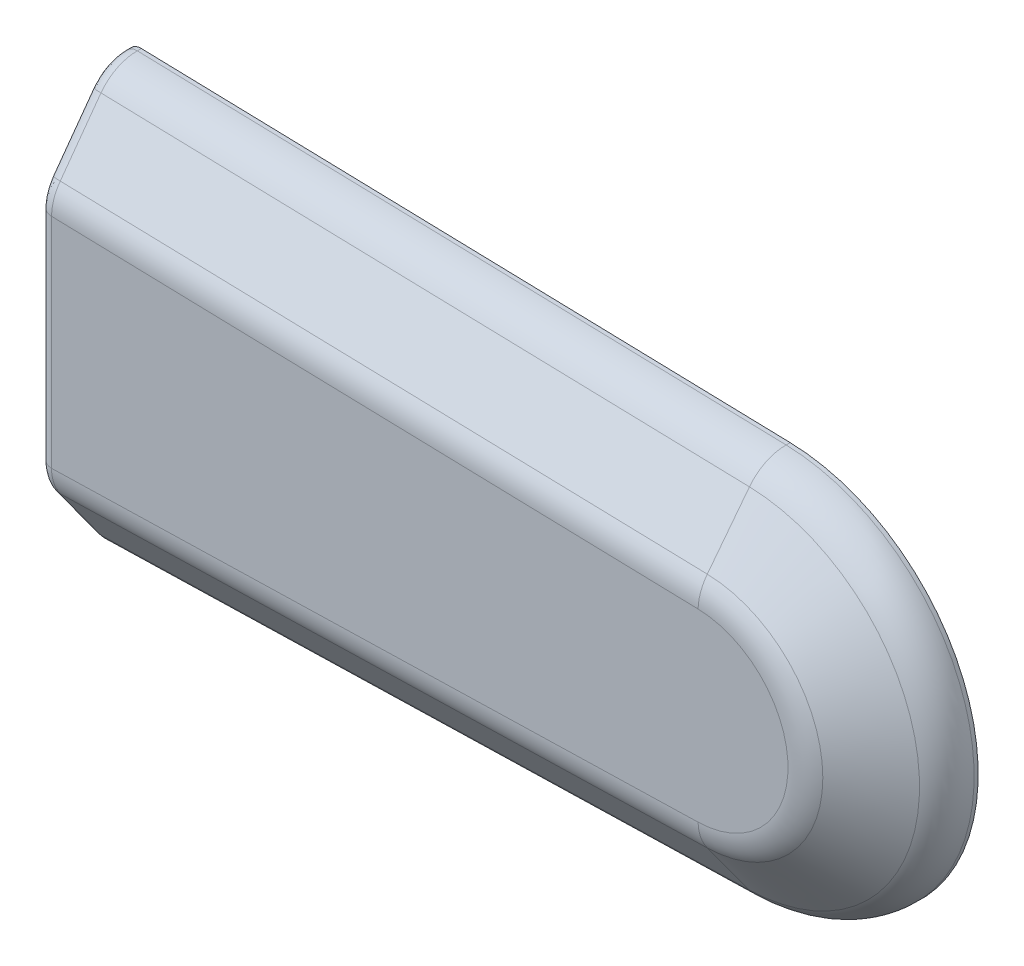
from build123d import *
from OCP.BRepFilletAPI import BRepFilletAPI_MakeChamfer

# Parameters (mm, degrees)
EXTRUDE_1_DEPTH     = 20
CUT_EXTRUDE_1_DEPTH = 215.709105536
CHAMFER_1_SIZE      = 14
CHAMFER_1_SIZE2     = 19.269346887
FILLET_1_R          = 10
FILLET_2_R          = 3
SKETCH_3_R          = 2.5
CUT_EXTRUDE_2_DEPTH = 10


with BuildPart() as part:
    # ｽｹｯﾁ1 → 押し出し1 (new body)
    with BuildSketch(Plane.XY):
        Polygon((0, 0), (0, 94), (192, 89), (192, 5), align=None)
    extrude(amount=EXTRUDE_1_DEPTH)

    # ｽｹｯﾁ2 → ｶｯﾄ - 押し出し1 (cut, through all)
    with BuildSketch(Plane.XY.offset(20)):
        with BuildLine():
            Line((192, 89), (148.123504516, 90.14261707))
            ThreePointArc((148.123504516, 90.14261707), (177.911446327, 77.116941346), (190.157243541, 47))
            ThreePointArc((190.157243541, 47), (177.911447055, 16.883059402), (148.123506603, 3.857382984))
            Line((148.123506603, 3.857382984), (192, 5))
            Line((192, 5), (192, 89))
        make_face()
    extrude(amount=-CUT_EXTRUDE_1_DEPTH, mode=Mode.SUBTRACT)

    # 面取り1: one chamfer whose edges measure the first distance from different faces: ONE call of the kernel's chamfer builder (chamfer() names one face for all edges)
    chamfer_1_edges_1 = [part.edges().sort_by_distance(p)[0] for p in [
        (74.061752258, 92.071308535, 20),
    ]]
    chamfer_1_side_1 = [part.faces().sort_by_distance(p)[0] for p in [
        (74.061752258, 92.071308535, 10),
    ]]
    chamfer_1_edges_2 = [part.edges().sort_by_distance(p)[0] for p in [
        (190.157243541, 47.000001044, 20),
    ]]
    chamfer_1_side_2 = [part.faces().sort_by_distance(p)[0] for p in [
        (190.157243541, 47.000001044, 10),
    ]]
    chamfer_1_edges_3 = [part.edges().sort_by_distance(p)[0] for p in [
        (74.061753301, 1.928691492, 20),
    ]]
    chamfer_1_side_3 = [part.faces().sort_by_distance(p)[0] for p in [
        (74.061753301, 1.928691492, 10),
    ]]
    chamfer_1 = BRepFilletAPI_MakeChamfer(part.part.solid().wrapped)
    for e in chamfer_1_edges_1:
        chamfer_1.Add(CHAMFER_1_SIZE, CHAMFER_1_SIZE2, e.wrapped, chamfer_1_side_1[0].wrapped)  # the first distance lies on this face
    for e in chamfer_1_edges_2:
        chamfer_1.Add(CHAMFER_1_SIZE, CHAMFER_1_SIZE2, e.wrapped, chamfer_1_side_2[0].wrapped)  # the first distance lies on this face
    for e in chamfer_1_edges_3:
        chamfer_1.Add(CHAMFER_1_SIZE, CHAMFER_1_SIZE2, e.wrapped, chamfer_1_side_3[0].wrapped)  # the first distance lies on this face
    add(Compound.cast(chamfer_1.Shape()), mode=Mode.REPLACE)

    # ﾌｨﾚｯﾄ1
    fillet_1_edges = [part.edges().sort_by_distance(p)[0] for p in [
        (73.810934338, 72.801960541, 20),
        (170.887896654, 47.000000578, 20),
        (73.810935381, 21.198039486, 20),
        (74.061753301, 1.928691492, 6),
        (190.157243541, 47.000001044, 6),
        (74.061752258, 92.071308535, 6),
    ]]
    fillet(fillet_1_edges, radius=FILLET_1_R)

    # ﾌｨﾚｯﾄ2
    fillet_2_edges = [part.edges().sort_by_distance(p)[0] for p in [
        (0, 47, 20),
        (0, 10.38493898, 13.542542696),
        (0, 0, 0.452372753),
        (0, 83.61506102, 13.542542696),
        (0, 94, 0.452372753),
        (0, 92.909567354, 5.44490235),
        (0, 74.564948876, 19.510594551),
        (0, 1.090432646, 5.44490235),
        (0, 19.435051124, 19.510594551),
    ]]
    fillet(fillet_2_edges, radius=FILLET_2_R)

    # ｽｹｯﾁ3 → ｶｯﾄ - 押し出し2 (cut)
    with BuildSketch(Plane(origin=(0, 0, 0), x_dir=(-1, 0, 0), z_dir=(0, 0, -1))):
        with Locations((-147, 47)):
            Circle(SKETCH_3_R)
    extrude(amount=-CUT_EXTRUDE_2_DEPTH, mode=Mode.SUBTRACT)


solid = part.part
